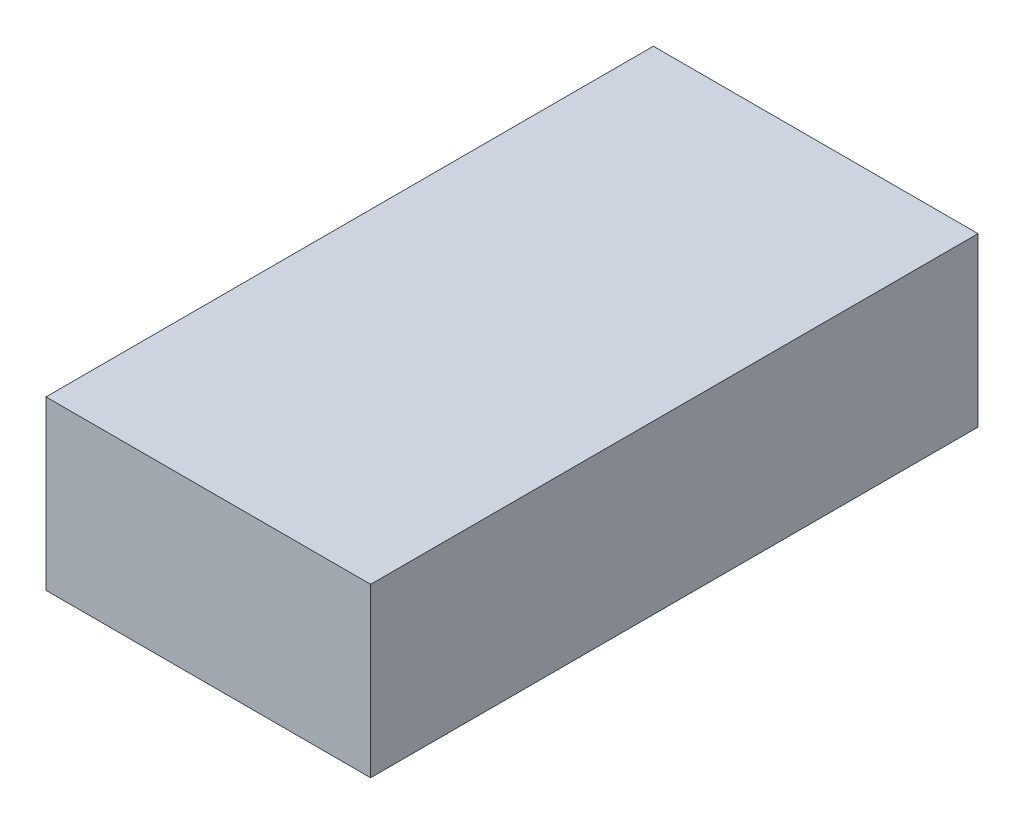
from build123d import *

# Parameters (mm, degrees)
SKETCH2_W           = 31
SKETCH2_H           = 58
BOSS_EXTRUDE1_DEPTH = 16


with BuildPart() as part:
    # Sketch2 → Boss-Extrude1 (new body)
    with BuildSketch(Plane(origin=(0, 0, 0), x_dir=(1, 0, 0), z_dir=(0, 1, 0))):
        with Locations((15.5, -29)):
            Rectangle(SKETCH2_W, SKETCH2_H)
    extrude(amount=BOSS_EXTRUDE1_DEPTH)


solid = part.part
